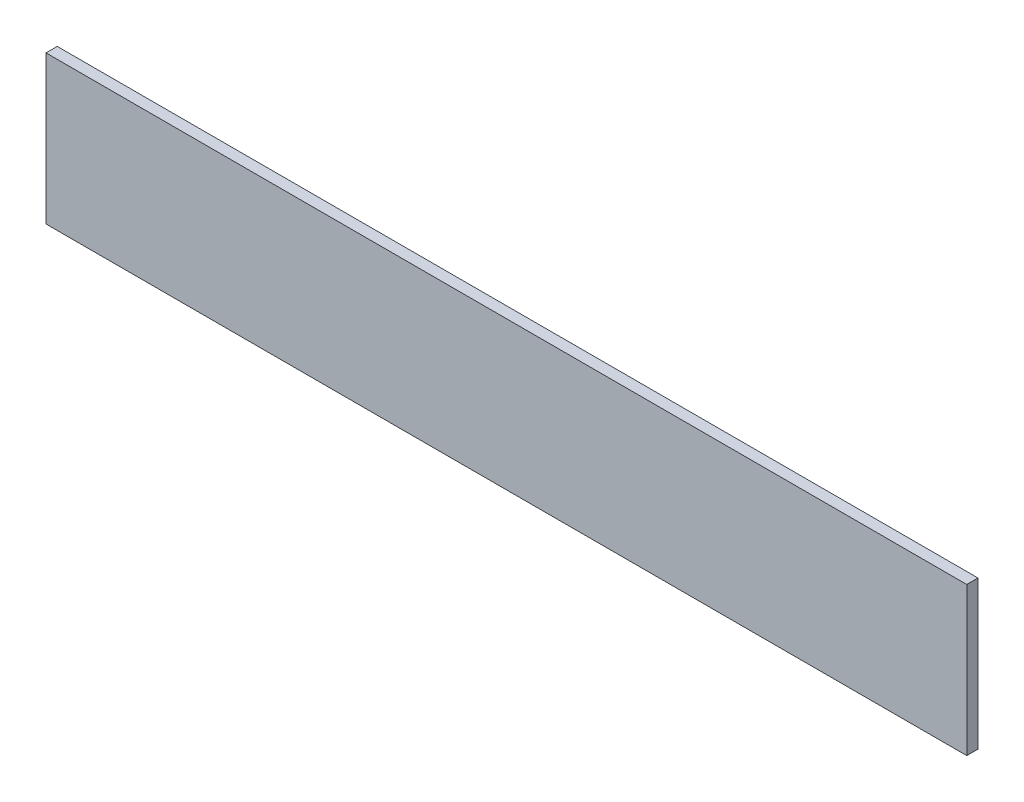
from build123d import *

# Parameters (mm, degrees)
SKETCH_1_W      = 410
SKETCH_1_H      = 66
EXTRUDE_1_DEPTH = 5


with BuildPart() as part:
    # 스케치1 → 보스-돌출1 (new body)
    with BuildSketch(Plane.XY):
        Rectangle(SKETCH_1_W, SKETCH_1_H)
    extrude(amount=EXTRUDE_1_DEPTH)


solid = part.part
